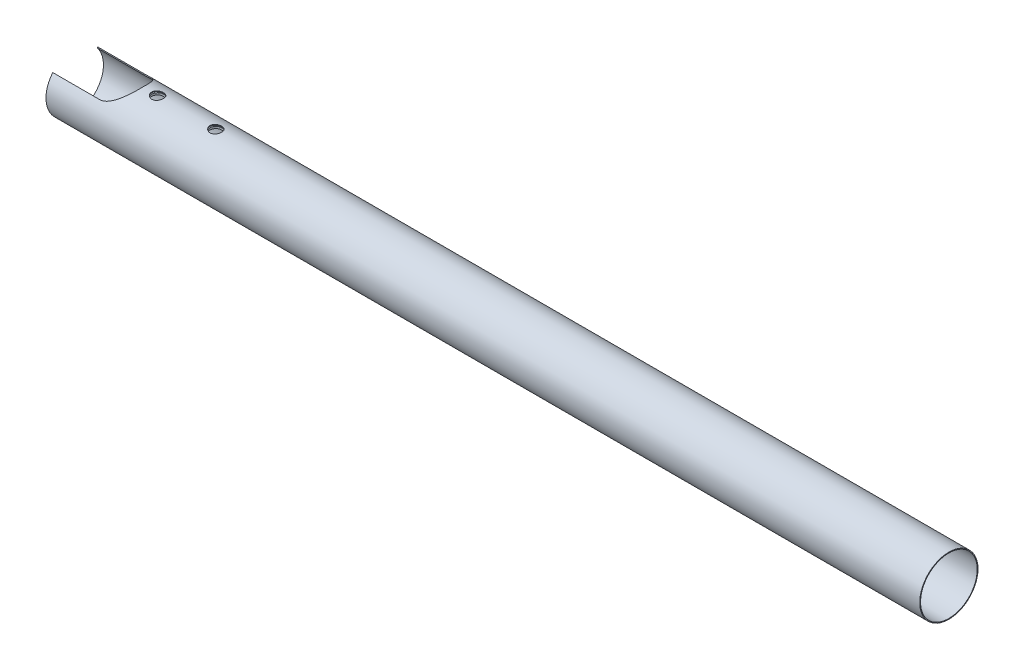
from build123d import *

# Parameters (mm, degrees)
ESQUISSE1_R             = 30
BASE_EXTRUSION_DEPTH    = 900
COQUE1_T                = -0.8
ENL_V_MAT_EXTRU_1_DEPTH = 100
ESQUISSE4_W             = 89
ESQUISSE4_H             = 20
BOSS_EXTRU_1_DEPTH      = 2
ESQUISSE3_R             = 6
ENL_V_MAT_EXTRU_2_DEPTH = 100


with BuildPart() as part:
    # Esquisse1 → Base-Extrusion (new body)
    with BuildSketch(Plane(origin=(0, 0, 0), x_dir=(0, 0, -1), z_dir=(1, 0, 0))):
        Circle(ESQUISSE1_R)
    extrude(amount=BASE_EXTRUSION_DEPTH)

    # Coque1
    coque1_openings = [part.faces().sort_by_distance(p)[0] for p in [
        (900, 0, 0),
        (0, 0, 0),
    ]]
    offset(amount=COQUE1_T, openings=coque1_openings, kind=Kind.INTERSECTION)

    # Esquisse2 → Enlèv. mat.-Extru.1 (cut)
    with BuildSketch(Plane(origin=(0, 0, 0), x_dir=(1, 0, 0), z_dir=(0, 1, 0))):
        with BuildLine():
            Line((-10, 23), (48, 23))
            ThreePointArc((48, 23), (63.556349186, 16.556349186), (70, 1))
            Line((70, 1), (70, -1))
            ThreePointArc((70, -1), (63.556349186, -16.556349186), (48, -23))
            Line((48, -23), (-10, -23))
            Line((-10, -23), (-10, 23))
        make_face()
    extrude(amount=ENL_V_MAT_EXTRU_1_DEPTH, mode=Mode.SUBTRACT)

    # Esquisse4 → Boss.-Extru.1 (add)
    with BuildSketch(Plane(origin=(0, 26, 0), x_dir=(-1, 0, 0), z_dir=(0, 1, 0))):
        with Locations((-115.5, 0)):
            Rectangle(ESQUISSE4_W, ESQUISSE4_H)
    extrude(amount=BOSS_EXTRU_1_DEPTH)

    # Esquisse3 → Enlèv. mat.-Extru.2 (cut)
    with BuildSketch(Plane(origin=(0, 0, 0), x_dir=(1, 0, 0), z_dir=(0, 1, 0))):
        with Locations(Location((85, 0, 0), (0, 0, 270))):
            Circle(ESQUISSE3_R)
        with Locations(Location((145, 0, 0), (0, 0, 270))):
            Circle(ESQUISSE3_R)
    extrude(amount=ENL_V_MAT_EXTRU_2_DEPTH, mode=Mode.SUBTRACT)


solid = part.part
